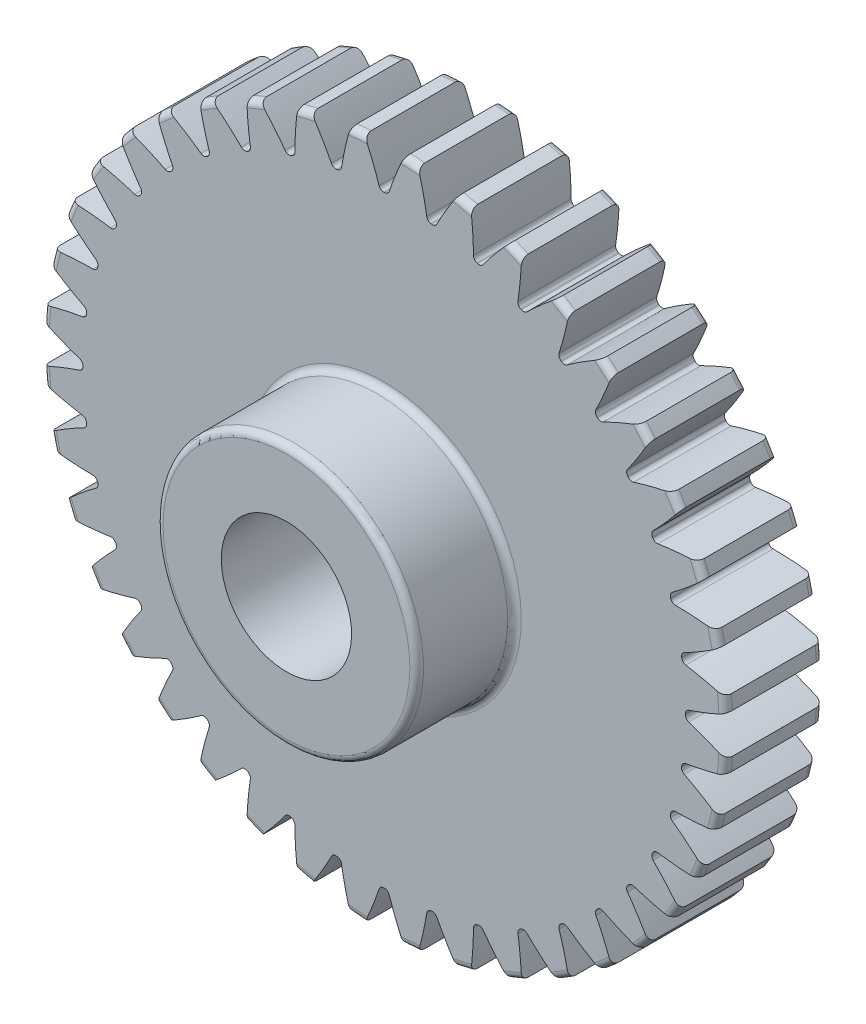
from build123d import *

# Parameters (mm, degrees)
FILLET2_R          = 0.42
CUT_EXTRUDE2_DEPTH = 31.298514904
CIRPATTERN1_COUNT  = 40


with BuildPart() as part:
    # Sketch4 → Revolve1 (revolve)
    with BuildSketch(Plane(origin=(0, 0, 0), x_dir=(0, 0, -1), z_dir=(1, 0, 0))):
        Polygon((-12, 4), (-12, 8), (-6, 8), (-6, 21), (0, 21), (0, 4), align=None)
    revolve(axis=Axis((0, 0, 6), (0, 0, 1)))

    # Fillet2
    fillet2_edges = [part.edges().sort_by_distance(p)[0] for p in [
        (0, -21, 0),
        (0, -21, 6),
        (0, -8, 6),
        (0, -8, 12),
    ]]
    fillet(fillet2_edges, radius=FILLET2_R)

    # Sketch7 → Cut-Extrude2 (cut, through all)
    with BuildSketch(Plane.XY.offset(6)):
        with BuildLine():
            ThreePointArc((-0.026958983, 18.499980357), (0, 18.5), (0.026958983, 18.499980357))
            ThreePointArc((0.026958983, 18.499980357), (0.202840783, 18.556625013), (0.312174396, 18.705585364))
            ThreePointArc((0.312174396, 18.705585364), (0.730273565, 19.848918998), (1.21715964, 20.96469705))
            ThreePointArc((1.21715964, 20.96469705), (0, 21), (-1.21715964, 20.96469705))
            ThreePointArc((-1.21715964, 20.96469705), (-0.730273565, 19.848918998), (-0.312174396, 18.705585364))
            ThreePointArc((-0.312174396, 18.705585364), (-0.202840783, 18.556625013), (-0.026958983, 18.499980357))
        make_face()
    cut_extrude2 = extrude(amount=-CUT_EXTRUDE2_DEPTH, mode=Mode.SUBTRACT)

    # CirPattern1: Cut-Extrude2 ×40 about axis
    cirpattern1_axis = Axis((0, 0, 0), (0, 0, 1))
    for i in range(1, CIRPATTERN1_COUNT):
        add(cut_extrude2.rotate(cirpattern1_axis, i * 360 / CIRPATTERN1_COUNT), mode=Mode.SUBTRACT)


solid = part.part
